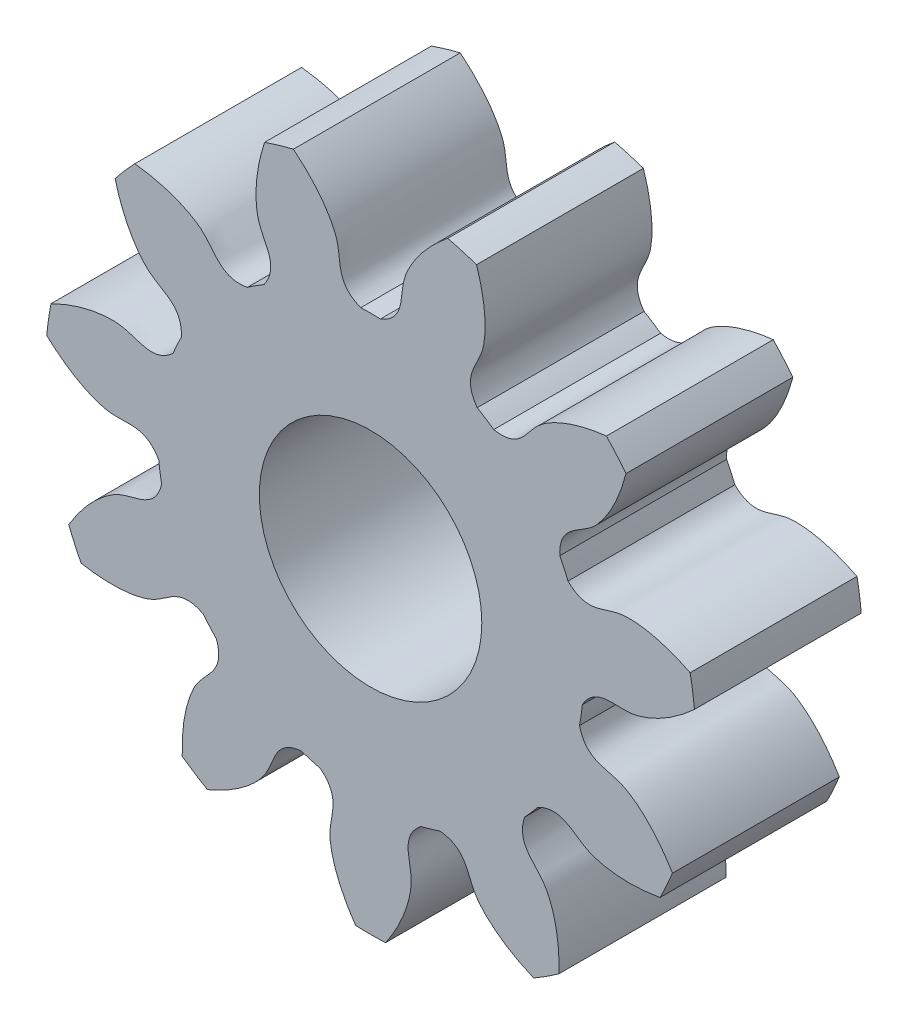
from build123d import *

# Parameters (mm, degrees)
SKETCH_1_R               = 2.925
EXTRUDE_1_DEPTH          = 1.5
CUT_EXTRUDE_1_DEPTH      = 5.400142043
PATTERN_CIRCULAR_1_COUNT = 11
SKETCH_4_R               = 1
CUT_EXTRUDE_2_DEPTH      = 5.391069685


with BuildPart() as part:
    # 草图1 → 凸台-拉伸1 (new body)
    with BuildSketch(Plane.XY):
        Circle(SKETCH_1_R)
    extrude(amount=EXTRUDE_1_DEPTH)

    # 草图2 → 切除-拉伸1 (cut, through all)
    with BuildSketch(Plane.XY):
        with BuildLine():
            ThreePointArc((0.08852987, 1.910449872), (0, 1.9125), (-0.08852987, 1.910449872))
            add(Edge.make_bspline(
                [(-0.08852987, 1.910449872), (-0.315659965, 2.000967152), (-0.258573558, 2.186101094), (-0.30708141, 2.343391426), (-0.309851997, 2.351784125), (-0.313099285, 2.36099721), (-0.316856321, 2.371014779), (-0.321156684, 2.381819732), (-0.326033159, 2.393394013), (-0.331518116, 2.405718553), (-0.337643355, 2.418773307), (-0.344440121, 2.432537255), (-0.351939064, 2.446988429), (-0.360170218, 2.462103917), (-0.369162977, 2.477859886), (-0.378946065, 2.494231597), (-0.389547516, 2.511193422), (-0.40099465, 2.52871886), (-0.413314046, 2.546780561), (-0.426531524, 2.565350339), (-0.440672115, 2.584399192), (-0.455760047, 2.60389733), (-0.471818719, 2.623814185), (-0.488870679, 2.644118439), (-0.506937607, 2.664778045), (-0.526040291, 2.685760249), (-0.54619861, 2.707031611), (-0.567431515, 2.728558032), (-0.589757009, 2.750304773), (-0.613192131, 2.772236485), (-0.637752937, 2.794317231), (-0.663454485, 2.816510508), (-0.690310819, 2.838779279), (-0.718334952, 2.861085995), (-0.747538853, 2.883392624), (-0.777933432, 2.905660673), (-0.809528526, 2.927851221), (-0.842332889, 2.949924944), (-0.876354178, 2.971842142), (-0.911598939, 2.99356277), (-0.948072603, 3.015046462), (-0.985779468, 3.036252566), (-1.024722698, 3.057140166), (-1.064904306, 3.077668119), (-1.106325154, 3.097795078), (-1.14898494, 3.117479524), (-1.192882194, 3.136679798), (-1.238014275, 3.155354129), (-1.284377358, 3.173460665), (-1.331966441, 3.190957502), (-1.380775332, 3.207802719), (-1.430796652, 3.223954403), (-1.482021826, 3.239370684), (-1.552511573, 3.259056282), (-1.606261107, 3.272328319), (-1.642556163, 3.280536787)],
                knots=[0, 0, 0, 0, 0.219011067, 0.222641587, 0.226699227, 0.231183987, 0.236095867, 0.241434867, 0.247200988, 0.253394228, 0.260014588, 0.267062068, 0.274536668, 0.282438388, 0.290767228, 0.299523189, 0.308706269, 0.318316469, 0.328353789, 0.338818229, 0.34970979, 0.36102847, 0.37277427, 0.38494719, 0.39754723, 0.410574391, 0.424028671, 0.437910071, 0.452218591, 0.466954232, 0.482116992, 0.497706872, 0.513723872, 0.530167993, 0.547039233, 0.564337593, 0.582063073, 0.600215674, 0.618795394, 0.637802234, 0.657236195, 0.677097275, 0.697385475, 0.718100796, 0.739243236, 0.760812796, 0.782809477, 0.805233277, 0.828084197, 0.851362238, 0.875067398, 0.899199678, 0.923759079, 0.948745599, 1, 1, 1, 1], degree=3))
            ThreePointArc((-1.642556163, 3.280536787), (0, 3.668775321), (1.642556163, 3.280536787))
            add(Edge.make_bspline(
                [(0.08852987, 1.910449872), (0.315659965, 2.000967152), (0.258573558, 2.186101094), (0.30708141, 2.343391426), (0.309851997, 2.351784125), (0.313099285, 2.36099721), (0.316856321, 2.371014779), (0.321156684, 2.381819732), (0.326033159, 2.393394013), (0.331518116, 2.405718553), (0.337643355, 2.418773307), (0.344440121, 2.432537255), (0.351939064, 2.446988429), (0.360170218, 2.462103917), (0.369162977, 2.477859886), (0.378946065, 2.494231597), (0.389547516, 2.511193422), (0.40099465, 2.52871886), (0.413314046, 2.546780561), (0.426531524, 2.565350339), (0.440672115, 2.584399192), (0.455760047, 2.60389733), (0.471818719, 2.623814185), (0.488870679, 2.644118439), (0.506937607, 2.664778045), (0.526040291, 2.685760249), (0.54619861, 2.707031611), (0.567431515, 2.728558032), (0.589757009, 2.750304773), (0.613192131, 2.772236485), (0.637752937, 2.794317231), (0.663454485, 2.816510508), (0.690310819, 2.838779279), (0.718334952, 2.861085995), (0.747538853, 2.883392624), (0.777933432, 2.905660673), (0.809528526, 2.927851221), (0.842332889, 2.949924944), (0.876354178, 2.971842142), (0.911598939, 2.99356277), (0.948072603, 3.015046462), (0.985779468, 3.036252566), (1.024722698, 3.057140166), (1.064904306, 3.077668119), (1.106325154, 3.097795078), (1.14898494, 3.117479524), (1.192882194, 3.136679798), (1.238014275, 3.155354129), (1.284377358, 3.173460665), (1.331966441, 3.190957502), (1.380775332, 3.207802719), (1.430796652, 3.223954403), (1.482021826, 3.239370684), (1.552511573, 3.259056282), (1.606261107, 3.272328319), (1.642556163, 3.280536787)],
                knots=[0, 0, 0, 0, 0.219011067, 0.222641587, 0.226699227, 0.231183987, 0.236095867, 0.241434867, 0.247200988, 0.253394228, 0.260014588, 0.267062068, 0.274536668, 0.282438388, 0.290767228, 0.299523189, 0.308706269, 0.318316469, 0.328353789, 0.338818229, 0.34970979, 0.36102847, 0.37277427, 0.38494719, 0.39754723, 0.410574391, 0.424028671, 0.437910071, 0.452218591, 0.466954232, 0.482116992, 0.497706872, 0.513723872, 0.530167993, 0.547039233, 0.564337593, 0.582063073, 0.600215674, 0.618795394, 0.637802234, 0.657236195, 0.677097275, 0.697385475, 0.718100796, 0.739243236, 0.760812796, 0.782809477, 0.805233277, 0.828084197, 0.851362238, 0.875067398, 0.899199678, 0.923759079, 0.948745599, 1, 1, 1, 1], degree=3))
        make_face()
    cut_extrude_1 = extrude(amount=CUT_EXTRUDE_1_DEPTH, mode=Mode.SUBTRACT)

    # 阵列(圆周)1: 切除-拉伸1 ×11 about axis
    pattern_circular_1_axis = Axis((0, 0, 1.5), (0, 0, -1))
    for i in range(1, PATTERN_CIRCULAR_1_COUNT):
        add(cut_extrude_1.rotate(pattern_circular_1_axis, i * 360 / PATTERN_CIRCULAR_1_COUNT), mode=Mode.SUBTRACT)

    # 草图4 → 切除-拉伸2 (cut, through all)
    with BuildSketch(Plane.XY.offset(1.5)):
        Circle(SKETCH_4_R)
    extrude(amount=-CUT_EXTRUDE_2_DEPTH, mode=Mode.SUBTRACT)


solid = part.part
